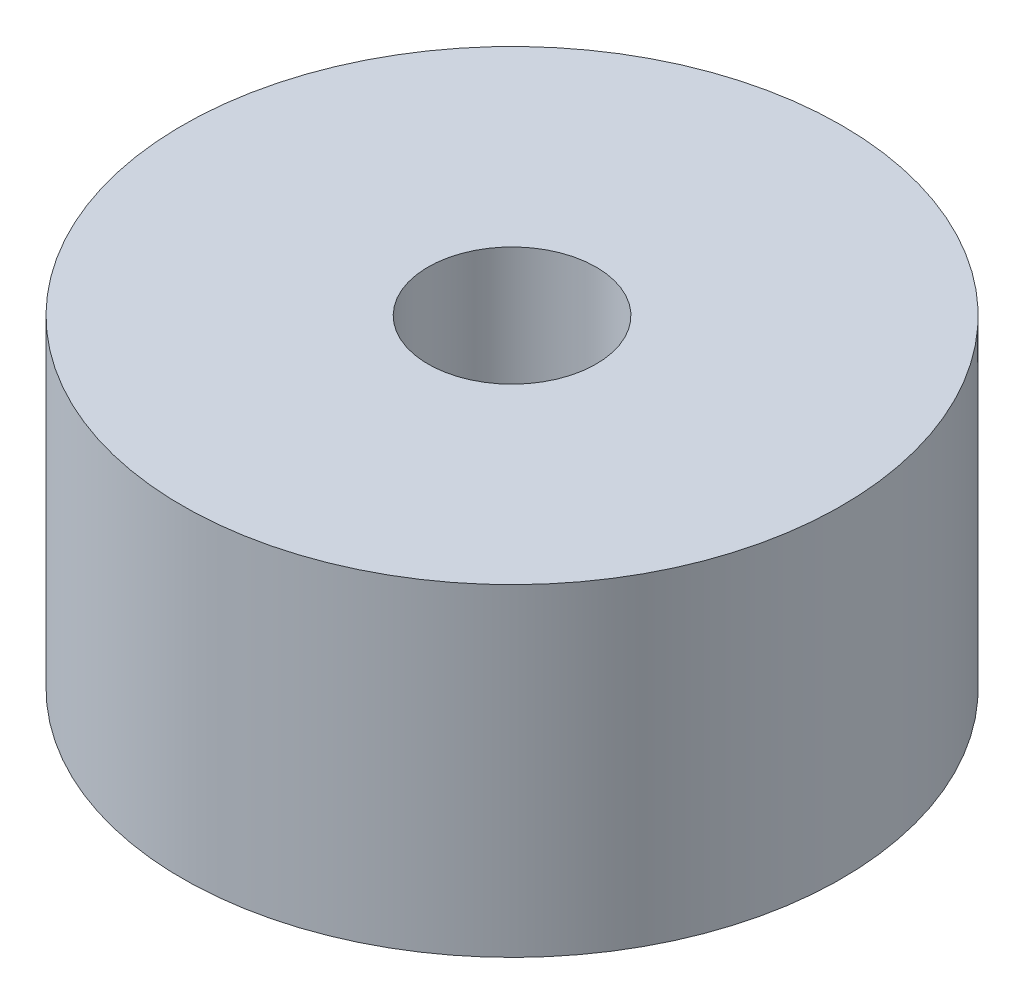
from build123d import *

# Parameters (mm, degrees)
SKETCH1_R           = 6.223
SKETCH1_R_2         = 1.5875
BOSS_EXTRUDE1_DEPTH = 6.096


with BuildPart() as part:
    # Sketch1 → Boss-Extrude1 (new body)
    with BuildSketch(Plane(origin=(0, 0, 0), x_dir=(1, 0, 0), z_dir=(0, 1, 0))):
        with Locations(Location((0, 0, 0), (0, 0, 90))):
            Circle(SKETCH1_R)
        with Locations(Location((0, 0, 0), (0, 0, 90))):
            Circle(SKETCH1_R_2, mode=Mode.SUBTRACT)
    extrude(amount=BOSS_EXTRUDE1_DEPTH)


solid = part.part
